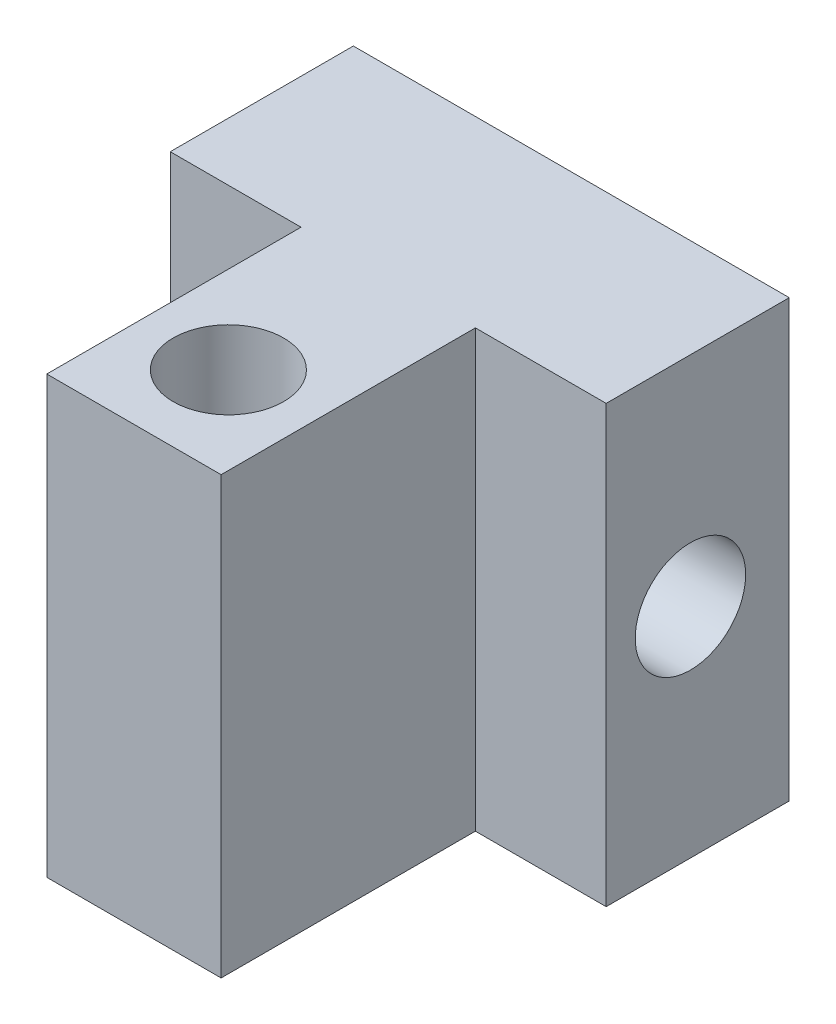
from build123d import *

# Parameters (mm, degrees)
SCHIZZO1_W                   = 60
SCHIZZO1_H                   = 60
ESTRUSIONE_ESTRUSIONE1_DEPTH = 60.2
SCHIZZO2_R                   = 7.6
TAGLIO_ESTRUSIONE1_DEPTH     = 105.038646666
SCHIZZO3_R                   = 7.6
TAGLIO_ESTRUSIONE2_DEPTH     = 105.038646666
SCHIZZO4_W                   = 18
SCHIZZO4_H                   = 60
TAGLIO_ESTRUSIONE3_DEPTH     = 35


with BuildPart() as part:
    # Schizzo1 → Estrusione-Estrusione1 (new body)
    with BuildSketch(Plane.XY):
        with Locations((-30, 30)):
            Rectangle(SCHIZZO1_W, SCHIZZO1_H)
    extrude(amount=ESTRUSIONE_ESTRUSIONE1_DEPTH)

    # Schizzo2 → Taglio-Estrusione1 (cut, through all)
    with BuildSketch(Plane(origin=(0, 0, 0), x_dir=(0, 0, -1), z_dir=(1, 0, 0))):
        with Locations((-13.6, 30)):
            Circle(SCHIZZO2_R)
    extrude(amount=-TAGLIO_ESTRUSIONE1_DEPTH, mode=Mode.SUBTRACT)

    # Schizzo3 → Taglio-Estrusione2 (cut, through all)
    with BuildSketch(Plane(origin=(0, 60, 0), x_dir=(0, 0, -1), z_dir=(0, 1, 0))):
        with Locations(Location((-47.2, 30, 0), (0, 0, 180))):
            Circle(SCHIZZO3_R)
    extrude(amount=-TAGLIO_ESTRUSIONE2_DEPTH, mode=Mode.SUBTRACT)

    # Schizzo4 → Taglio-Estrusione3 (cut)
    with BuildSketch(Plane.XY.offset(60.2)):
        with Locations((-51, 30)):
            Rectangle(SCHIZZO4_W, SCHIZZO4_H)
        with Locations((-9, 30)):
            Rectangle(SCHIZZO4_W, SCHIZZO4_H)
    extrude(amount=-TAGLIO_ESTRUSIONE3_DEPTH, mode=Mode.SUBTRACT)


solid = part.part
